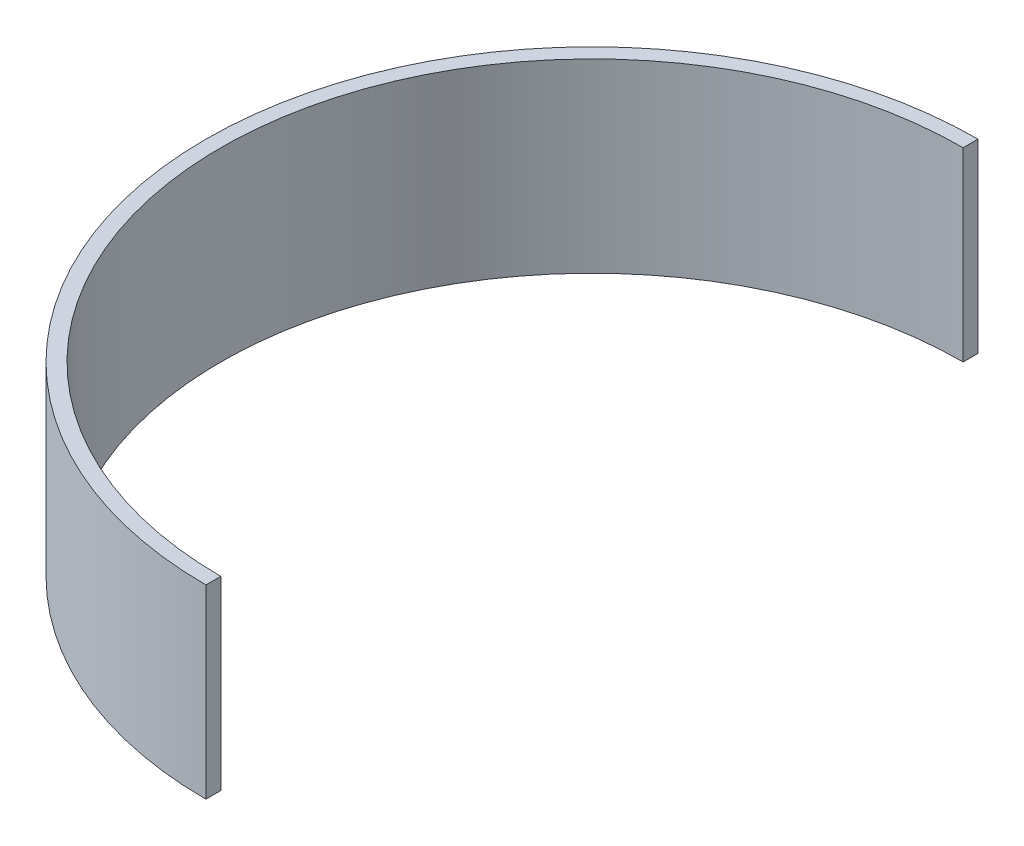
from build123d import *

# Parameters (mm, degrees)
SKETCH_8_R               = 5.2
EXTRUDE_4_DEPTH          = 2.5
CUT_EXTRUDE_8_DEPTH      = 2.5
CUT_EXTRUDE_8_DEPTH_BACK = 2.5
SKETCH_11_R              = 5
CUT_EXTRUDE_9_DEPTH      = 2.5
CUT_EXTRUDE_9_DEPTH_BACK = 2.5
SKETCH_12_W              = 11.101506765
SKETCH_12_H              = 17.426783875


with BuildPart() as part:
    # 草图8 → 凸台-拉伸4 (new body)
    with BuildSketch(Plane(origin=(0, 0, 0), x_dir=(1, 0, 0), z_dir=(0, 1, 0))):
        Circle(SKETCH_8_R)
    extrude(amount=EXTRUDE_4_DEPTH)

    # 草图11 → 切除-拉伸8 (cut, two sides: drawn at the far end of the back side and taken through both)
    with BuildSketch(Plane(origin=(0, 0, 0), x_dir=(1, 0, 0), z_dir=(0, 1, 0)).offset(-CUT_EXTRUDE_8_DEPTH_BACK)):
        Circle(SKETCH_11_R)
    extrude(amount=CUT_EXTRUDE_8_DEPTH + CUT_EXTRUDE_8_DEPTH_BACK, mode=Mode.SUBTRACT)

    # 草图12 → 切除-拉伸9 (cut, two sides: drawn at the far end of the back side and taken through both)
    with BuildSketch(Plane(origin=(0, 0, 0), x_dir=(1, 0, 0), z_dir=(0, 1, 0)).offset(-CUT_EXTRUDE_9_DEPTH_BACK)):
        with Locations((5.550753382, -1.742678388)):
            Rectangle(SKETCH_12_W, SKETCH_12_H)
    extrude(amount=CUT_EXTRUDE_9_DEPTH + CUT_EXTRUDE_9_DEPTH_BACK, mode=Mode.SUBTRACT)


solid = part.part
